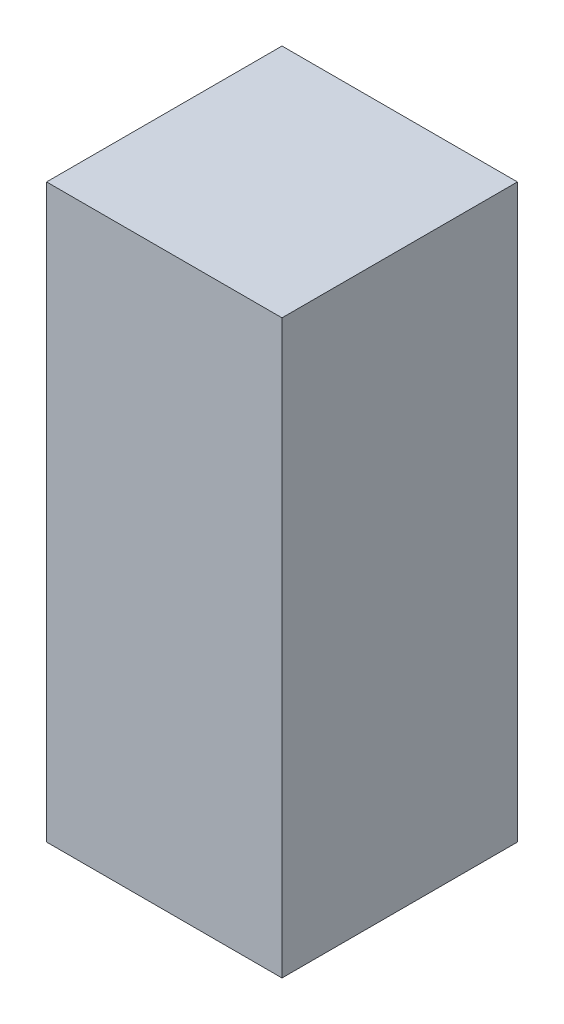
from build123d import *

# Parameters (mm, degrees)
CROQUIS1_W              = 7
CROQUIS1_H              = 7
SALIENTE_EXTRUIR1_DEPTH = 8.5


with BuildPart() as part:
    # Croquis1 → Saliente-Extruir1 (new, symmetric)
    with BuildSketch(Plane(origin=(0, 0, 0), x_dir=(1, 0, 0), z_dir=(0, 1, 0))):
        Rectangle(CROQUIS1_W, CROQUIS1_H)
    extrude(amount=SALIENTE_EXTRUIR1_DEPTH, both=True)


solid = part.part
